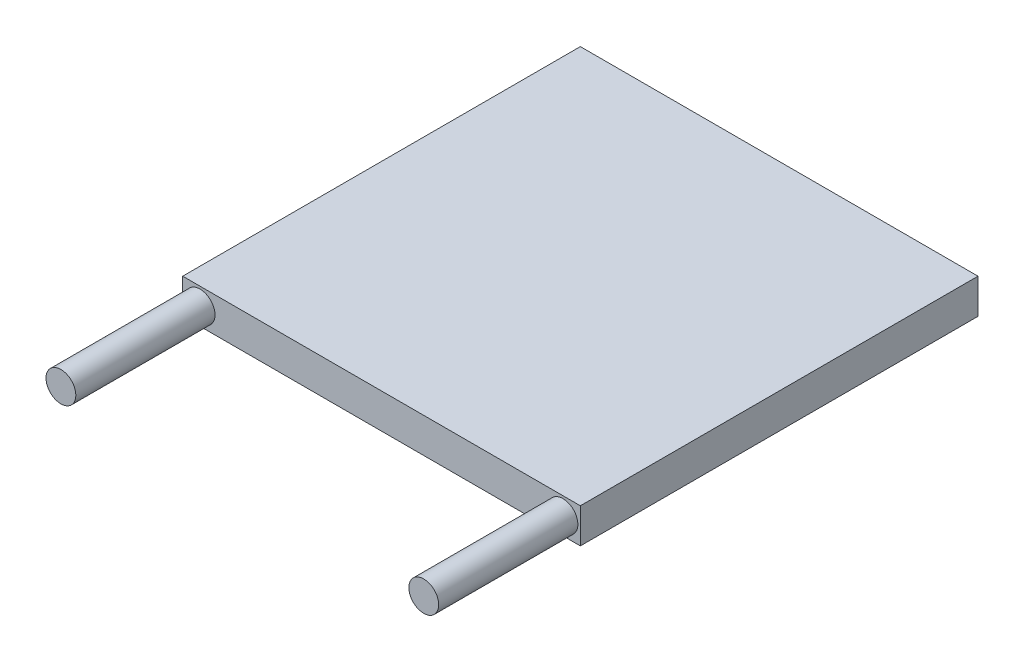
from build123d import *

# Parameters (mm, degrees)
SKETCH1_W           = 40
SKETCH1_H           = 40
BOSS_EXTRUDE1_DEPTH = 3.5
SKETCH2_R           = 1.5
BOSS_EXTRUDE2_DEPTH = 14


with BuildPart() as part:
    # Sketch1 → Boss-Extrude1 (new body)
    with BuildSketch(Plane(origin=(0, 0, 0), x_dir=(1, 0, 0), z_dir=(0, 1, 0))):
        Rectangle(SKETCH1_W, SKETCH1_H)
    extrude(amount=BOSS_EXTRUDE1_DEPTH)

    # Sketch2 → Boss-Extrude2 (add)
    with BuildSketch(Plane.XY.offset(20)):
        with Locations((18.25, 1.75)):
            Circle(SKETCH2_R)
        with Locations(Location((-18.25, 1.75, 0), (0, 0, 180))):
            Circle(SKETCH2_R)
    extrude(amount=BOSS_EXTRUDE2_DEPTH)


solid = part.part
